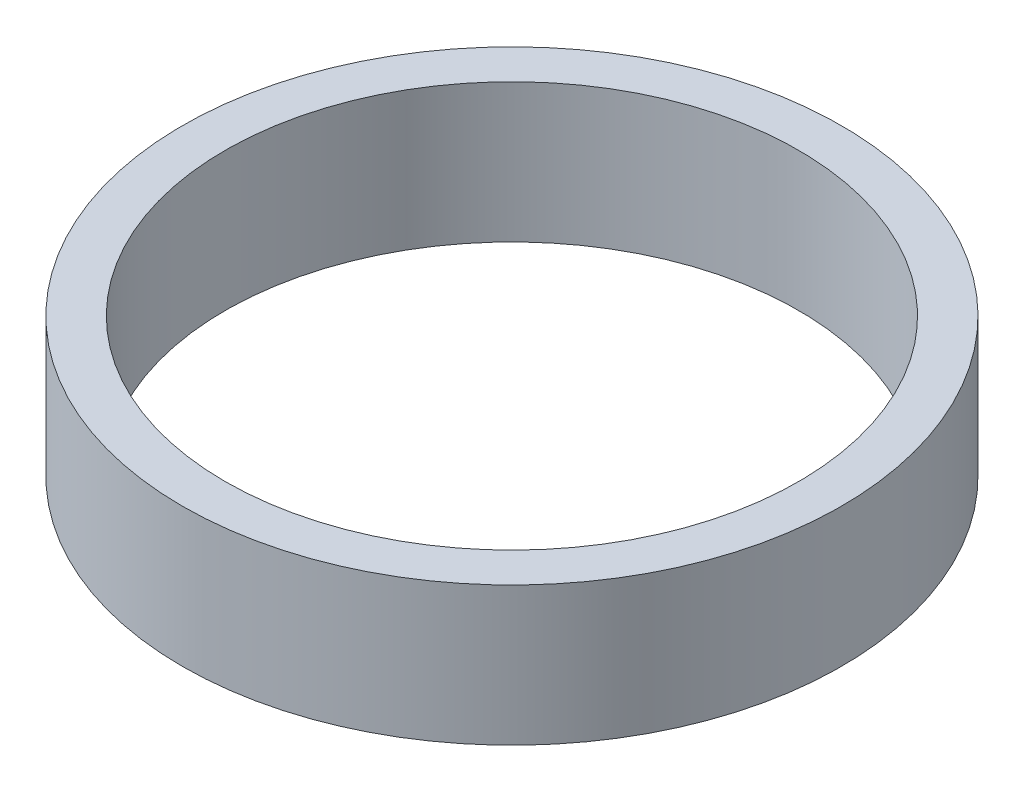
from build123d import *

# Parameters (mm, degrees)
SKETCH1_R           = 30.1625
SKETCH1_R_2         = 26.2509
BOSS_EXTRUDE1_DEPTH = 12.7


with BuildPart() as part:
    # Sketch1 → Boss-Extrude1 (new body)
    with BuildSketch(Plane(origin=(0, 0, 0), x_dir=(1, 0, 0), z_dir=(0, 1, 0))):
        with Locations(Location((0, 0, 0), (0, 0, 270))):
            Circle(SKETCH1_R)
        with Locations(Location((0, 0, 0), (0, 0, 270))):
            Circle(SKETCH1_R_2, mode=Mode.SUBTRACT)
    extrude(amount=BOSS_EXTRUDE1_DEPTH)


solid = part.part
